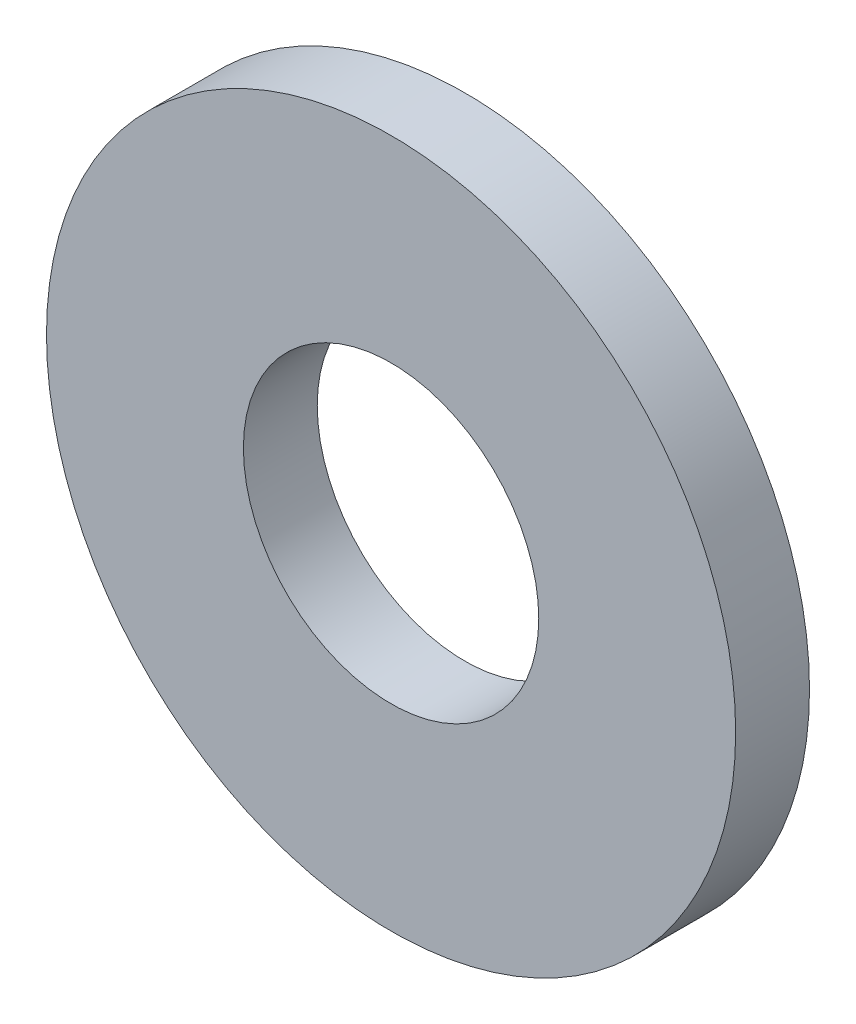
from build123d import *

# Parameters (mm, degrees)
SKETCH1_R      = 7
SKETCH1_R_2    = 3
EXTRUDE1_DEPTH = 1.5


with BuildPart() as part:
    # Sketch1 → Extrude1 (new body)
    with BuildSketch(Plane.XY):
        Circle(SKETCH1_R)
        Circle(SKETCH1_R_2, mode=Mode.SUBTRACT)
    extrude(amount=EXTRUDE1_DEPTH)


solid = part.part
